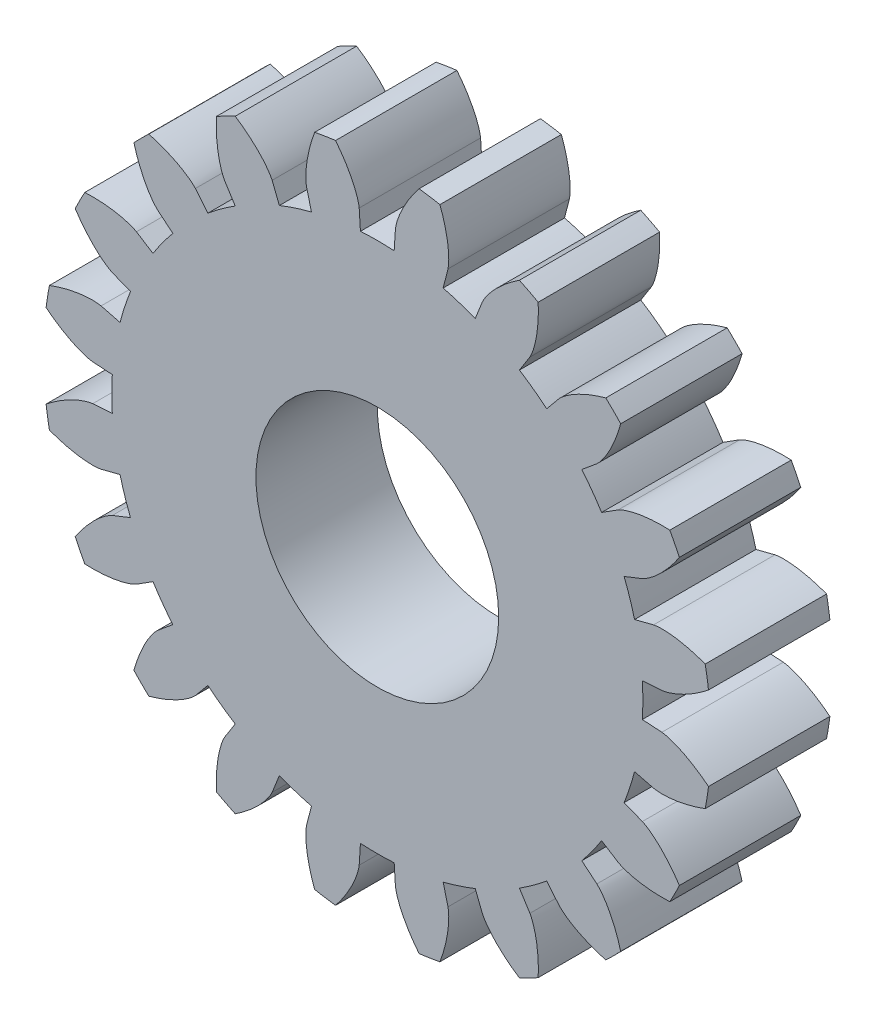
from build123d import *

# Parameters (mm, degrees)
SKETCH1_R           = 27.5
BOSS_EXTRUDE1_DEPTH = 5
CUT_EXTRUDE1_DEPTH  = 41.155946011
CUT_EXTRUDE2_DEPTH  = 41.155946172
CIRPATTERN1_COUNT   = 20
SKETCH5_R           = 10
CUT_EXTRUDE3_DEPTH  = 40.860026837


with BuildPart() as part:
    # Sketch1 → Boss-Extrude1 (new, symmetric)
    with BuildSketch(Plane.XY):
        Circle(SKETCH1_R)
    extrude(amount=BOSS_EXTRUDE1_DEPTH, both=True)

    # Sketch2 → Cut-Extrude1 (cut, through all)
    with BuildSketch(Plane.XY.offset(5)):
        with BuildLine():
            ThreePointArc((-1.492192858, 23.442556611), (0, 23.49), (1.492192858, 23.442556611))
            add(Edge.make_bspline(
                [(1.492192858, 23.442556611), (1.509703149, 23.613515204), (1.598056956, 23.990887646), (1.822980926, 24.640546676), (2.205804226, 25.458419905), (3.090420272, 26.93307024), (4.021139918, 28.014218864), (4.755897678, 28.734820989)],
                knots=[0, 0, 0, 0, 0.081635884, 0.183676701, 0.326533469, 0.510206256, 1, 1, 1, 1], degree=3))
            ThreePointArc((4.755897678, 28.734820989), (0, 29.149189424), (-4.755897678, 28.734820989))
            add(Edge.make_bspline(
                [(-1.492192858, 23.442556611), (-1.509703149, 23.613515204), (-1.598056956, 23.990887646), (-1.822980926, 24.640546676), (-2.205804226, 25.458419905), (-3.090420272, 26.93307024), (-4.021139918, 28.014218864), (-4.755897678, 28.734820989)],
                knots=[0, 0, 0, 0, 0.081635884, 0.183676701, 0.326533469, 0.510206256, 1, 1, 1, 1], degree=3))
        make_face()
    cut_extrude1 = extrude(amount=-CUT_EXTRUDE1_DEPTH, mode=Mode.SUBTRACT)

    # Sketch4 → Cut-Extrude2 (cut, through all)
    with BuildSketch(Plane.XY.offset(5)):
        with BuildLine():
            Line((-1.492192858, 23.442556611), (-1.389600629, 21.830818471))
            ThreePointArc((-1.389600629, 21.830818471), (0, 21.875), (1.389600629, 21.830818471))
            Line((1.389600629, 21.830818471), (1.492192858, 23.442556611))
            ThreePointArc((1.492192858, 23.442556611), (0, 23.49), (-1.492192858, 23.442556611))
        make_face()
    cut_extrude2 = extrude(amount=-CUT_EXTRUDE2_DEPTH, mode=Mode.SUBTRACT)

    # CirPattern1: Cut-Extrude1, Cut-Extrude2 ×20 about axis
    cirpattern1_axis = Axis((0, 0, 5), (0, 0, -1))
    add([cut_extrude1.rotate(cirpattern1_axis, i * 360 / CIRPATTERN1_COUNT) for i in range(1, CIRPATTERN1_COUNT)], mode=Mode.SUBTRACT)
    add([cut_extrude2.rotate(cirpattern1_axis, i * 360 / CIRPATTERN1_COUNT) for i in range(1, CIRPATTERN1_COUNT)], mode=Mode.SUBTRACT)

    # Sketch5 → Cut-Extrude3 (cut, through all)
    with BuildSketch(Plane.XY.offset(5)):
        Circle(SKETCH5_R)
    extrude(amount=-CUT_EXTRUDE3_DEPTH, mode=Mode.SUBTRACT)


solid = part.part
